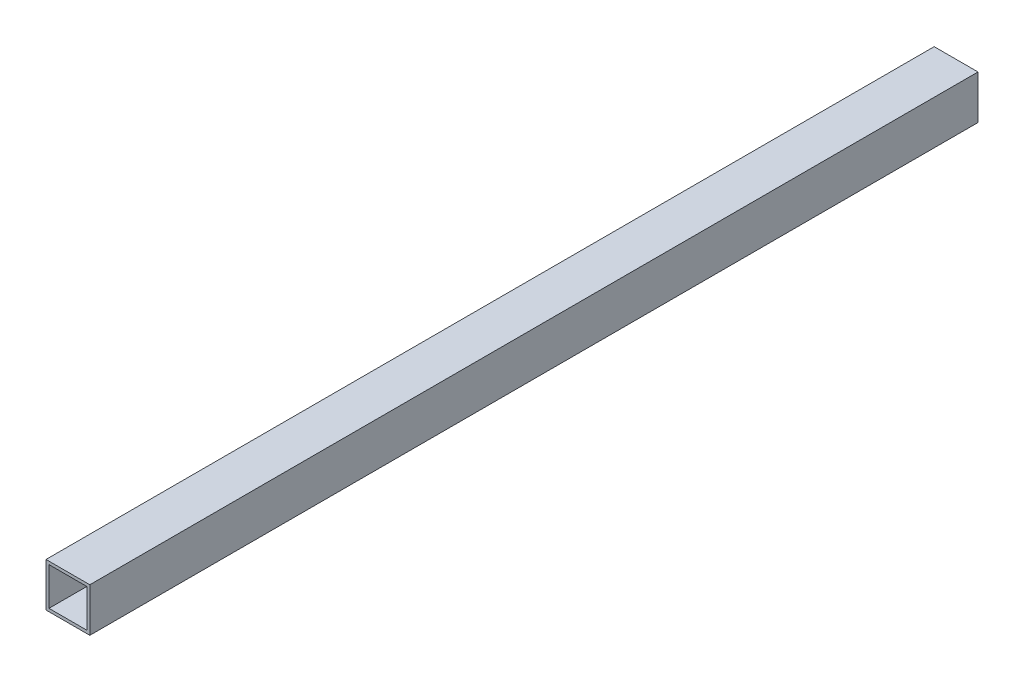
from build123d import *

# Parameters (mm, degrees)
SKETCH1_W           = 14.8
SKETCH1_H           = 14.8
SKETCH1_W_2         = 12.8
SKETCH1_H_2         = 12.8
BOSS_EXTRUDE1_DEPTH = 300


with BuildPart() as part:
    # Sketch1 → Boss-Extrude1 (new body)
    with BuildSketch(Plane.XY):
        Rectangle(SKETCH1_W, SKETCH1_H)
        Rectangle(SKETCH1_W_2, SKETCH1_H_2, mode=Mode.SUBTRACT)
    extrude(amount=BOSS_EXTRUDE1_DEPTH)


solid = part.part
